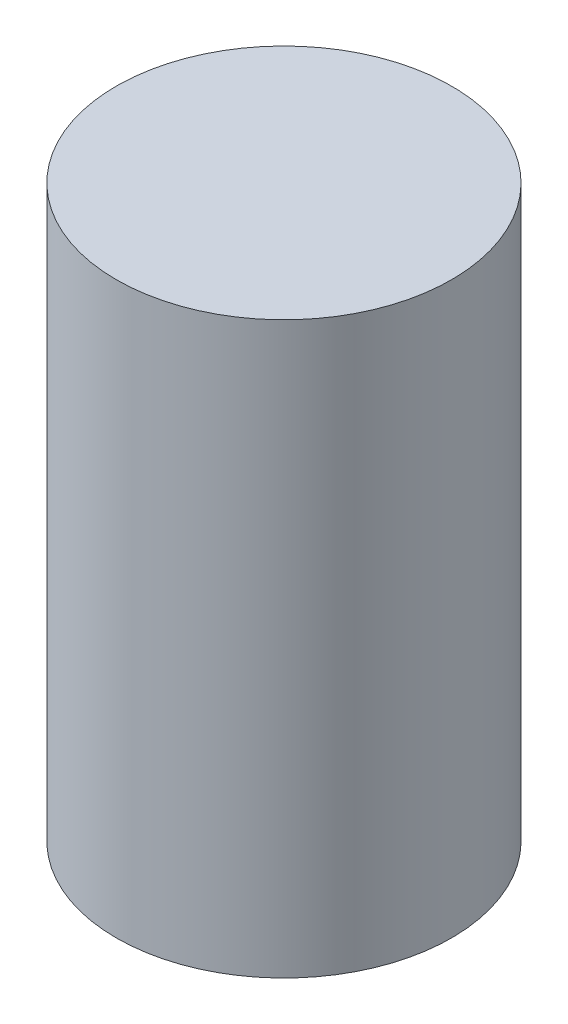
from build123d import *

# Parameters (mm, degrees)
SKETCH1_R           = 2
BOSS_EXTRUDE1_DEPTH = 6.8


with BuildPart() as part:
    # Sketch1 → Boss-Extrude1 (new body)
    with BuildSketch(Plane(origin=(0, 0, 0), x_dir=(1, 0, 0), z_dir=(0, 1, 0))):
        with Locations(Location((0, 0, 0), (0, 0, 270))):
            Circle(SKETCH1_R)
    extrude(amount=BOSS_EXTRUDE1_DEPTH)


solid = part.part
